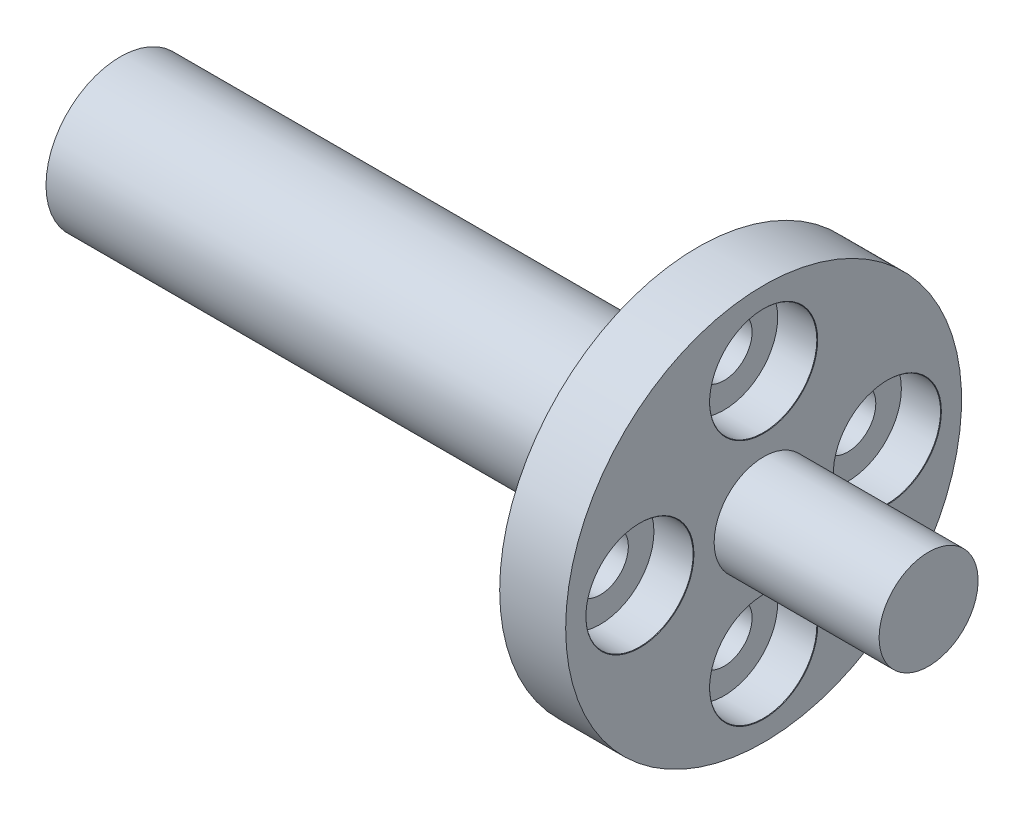
from build123d import *

# Parameters (mm, degrees)
CBORE_FOR_M3_HEX_SOCKET_THIN_HEAD_CA_2_COUNT = 2
CBORE_FOR_M3_HEX_SOCKET_THIN_HEAD_CA_2_PITCH = 10.606601718
CBORE_FOR_M3_HEX_SOCKET_THIN_HEAD_CA_3_COUNT = 2
CBORE_FOR_M3_HEX_SOCKET_THIN_HEAD_CA_3_PITCH = 15
CBORE_FOR_M3_HEX_SOCKET_THIN_HEAD_CA_4_COUNT = 2
CBORE_FOR_M3_HEX_SOCKET_THIN_HEAD_CA_4_PITCH = 10.606601718


with BuildPart() as part:
    # Sketch1 → Revolve1 (revolve)
    with BuildSketch(Plane.XY, mode=Mode.PRIVATE) as revolve1_sk:
        Polygon((49, 0), (49, 3), (39, 3), (39, 12), (35, 12), (35, 4.5), (0, 4.5), (0, 0), align=None)
    revolve(revolve1_sk.sketch.rotate(Axis((0, 0, 0), (1, 0, 0)), 90), axis=Axis((0, 0, 0), (1, 0, 0)))

    # Sketch3 → CBORE for M3 Hex Socket Thin Head Cap Screw1 (revolve, cut)
    with BuildSketch(Plane(origin=(39, 0, 7.5), x_dir=(0, 0, -1), z_dir=(0, 1, 0))):
        Polygon((0, 0), (0, 39), (1.7, 39), (1.7, 2.4), (3.25, 2.4), (3.25, 0.025), (3.275, 0), align=None)
    cbore_for_m3_hex_socket_thin_head_cap_sc = revolve(axis=Axis((45.35, 0, 7.5), (-1, 0, 0)), mode=Mode.SUBTRACT)

    # CBORE for M3 Hex Socket Thin Head Ca 2: CBORE for M3 Hex Socket Thin Head Cap Screw1 ×2
    with Locations(*[Vector(0, 0.7071067811865674, -0.7071067811865277) * (i * CBORE_FOR_M3_HEX_SOCKET_THIN_HEAD_CA_2_PITCH) for i in range(1, CBORE_FOR_M3_HEX_SOCKET_THIN_HEAD_CA_2_COUNT)]):
        add(cbore_for_m3_hex_socket_thin_head_cap_sc, mode=Mode.SUBTRACT)

    # CBORE for M3 Hex Socket Thin Head Ca 3: CBORE for M3 Hex Socket Thin Head Cap Screw1 ×2
    with Locations(*[(0, 0, -i * CBORE_FOR_M3_HEX_SOCKET_THIN_HEAD_CA_3_PITCH) for i in range(1, CBORE_FOR_M3_HEX_SOCKET_THIN_HEAD_CA_3_COUNT)]):
        add(cbore_for_m3_hex_socket_thin_head_cap_sc, mode=Mode.SUBTRACT)

    # CBORE for M3 Hex Socket Thin Head Ca 4: CBORE for M3 Hex Socket Thin Head Cap Screw1 ×2
    with Locations(*[Vector(0, -0.7071067811865276, -0.7071067811865674) * (i * CBORE_FOR_M3_HEX_SOCKET_THIN_HEAD_CA_4_PITCH) for i in range(1, CBORE_FOR_M3_HEX_SOCKET_THIN_HEAD_CA_4_COUNT)]):
        add(cbore_for_m3_hex_socket_thin_head_cap_sc, mode=Mode.SUBTRACT)


solid = part.part
